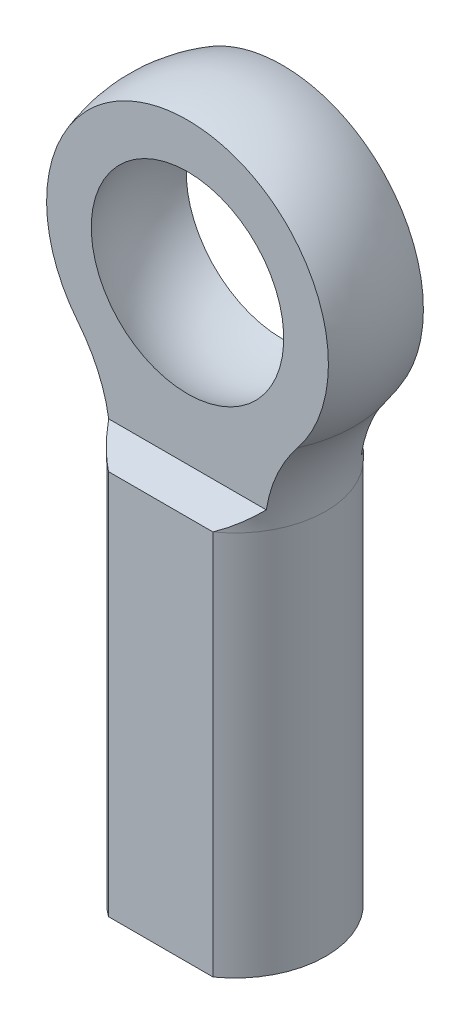
from build123d import *

# Parameters (mm, degrees)
SKETCH17_W              = 7.1501
SKETCH17_H              = 68.2625
EXTRUDE3_DEPTH          = 63.5
CUT_EXTRUDE1_DEPTH      = 45.878768644
CUT_EXTRUDE1_DEPTH_BACK = 45.878768644


with BuildPart() as part:
    # Sketch15 → Revolve4 (revolve)
    with BuildSketch(Plane.XY, mode=Mode.PRIVATE) as revolve4_sk:
        Polygon((4.7625, -26.9875), (8.7249, -26.9875), (8.7249, 10.047604155), (0, 10.047604155), (0, 0), (4.7625, 0), align=None)
    revolve(revolve4_sk.sketch.rotate(Axis((0, 41.275, 0), (0, -1, 0)), 180), axis=Axis((0, 41.275, 0), (0, -1, 0)))

    # Sketch4 → Revolve2 (revolve)
    with BuildSketch(Plane.XY):
        with BuildLine():
            Line((0, 16.6751), (0, 10.047604155))
            Line((0, 10.047604155), (8.7249, 10.047604155))
            ThreePointArc((8.7249, 10.047604155), (9.438021768, 14.505059918), (11.5062, 18.517552077))
            ThreePointArc((11.5062, 18.517552077), (12.750432094, 33.434137701), (0, 41.275))
            Line((0, 41.275), (0, 37.2999))
            ThreePointArc((0, 37.2999), (10.3124, 26.9875), (0, 16.6751))
        make_face()
    revolve(axis=Axis((0, 41.275, 0), (0, 1, 0)))

    # Sketch17 → Extrude3 (cut, symmetric)
    with BuildSketch(Plane(origin=(0, 0, 0), x_dir=(0, 0, -1), z_dir=(1, 0, 0))):
        with Locations((-10.71245, 7.14375)):
            Rectangle(SKETCH17_W, SKETCH17_H)
        with Locations((10.71245, 7.14375)):
            Rectangle(SKETCH17_W, SKETCH17_H)
    extrude(amount=EXTRUDE3_DEPTH, both=True, mode=Mode.SUBTRACT)

    # Sketch5 → Cut-Extrude1 (cut, two sides: drawn at the far end of the back side and taken through both)
    with BuildSketch(Plane(origin=(0, 0, 0), x_dir=(0, 0, -1), z_dir=(1, 0, 0)).offset(-CUT_EXTRUDE1_DEPTH_BACK)):
        Polygon((4.5640625, 41.275), (12.2174, 41.275), (12.2174, 10.047604155), (7.1374, 10.047604155), (4.5640625, 11.873229155), align=None)
        Polygon((-4.5640625, 41.275), (-4.5640625, 11.873229155), (-7.1374, 10.047604155), (-12.2174, 10.047604155), (-12.2174, 41.275), align=None)
    extrude(amount=CUT_EXTRUDE1_DEPTH + CUT_EXTRUDE1_DEPTH_BACK, mode=Mode.SUBTRACT)


solid = part.part
